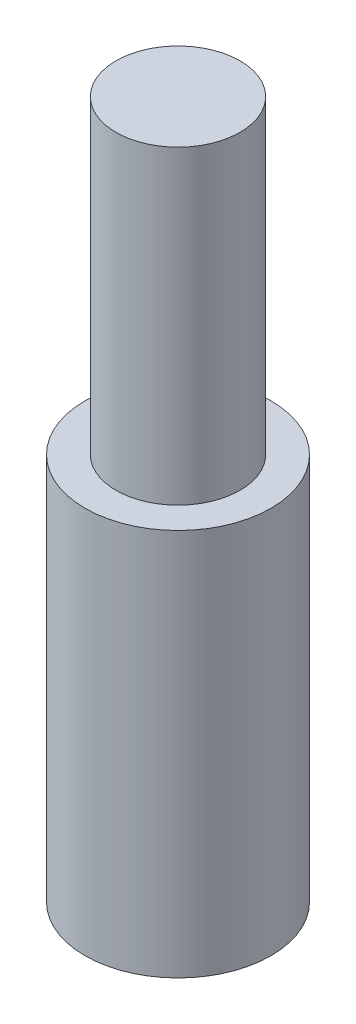
from build123d import *


with BuildPart() as part:
    # Skizze1 → Rotation3 (revolve)
    with BuildSketch(Plane.XY, mode=Mode.PRIVATE) as rotation3_sk:
        Polygon((0, 45), (0, 0), (6, 0), (6, 25), (4, 25), (4, 45), align=None)
    revolve(rotation3_sk.sketch.rotate(Axis((0, -3.346016205, 0), (0, 1, 0)), 90), axis=Axis((0, -3.346016205, 0), (0, 1, 0)))


solid = part.part
